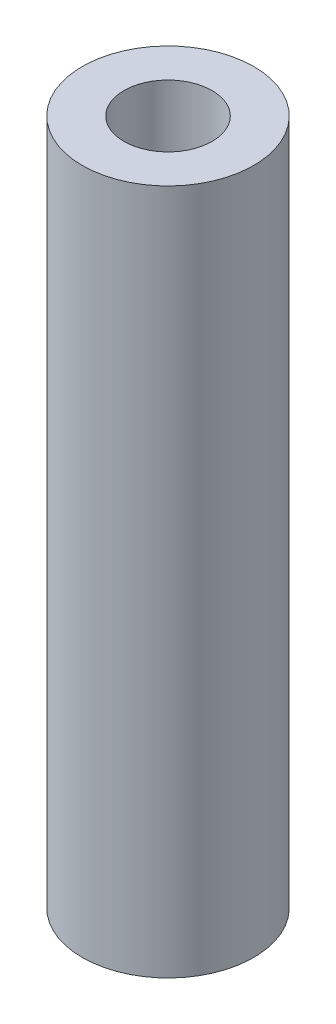
from build123d import *

# Parameters (mm, degrees)
SKETCH1_R           = 3.175
BOSS_EXTRUDE1_DEPTH = 25.4
SKETCH2_R           = 1.63195
CUT_EXTRUDE1_DEPTH  = 26.793821935


with BuildPart() as part:
    # Sketch1 → Boss-Extrude1 (new body)
    with BuildSketch(Plane(origin=(0, 0, 0), x_dir=(1, 0, 0), z_dir=(0, 1, 0))):
        with Locations(Location((0, 0, 0), (0, 0, 270))):
            Circle(SKETCH1_R)
    extrude(amount=BOSS_EXTRUDE1_DEPTH)

    # Sketch2 → Cut-Extrude1 (cut, through all)
    with BuildSketch(Plane(origin=(0, 25.4, 0), x_dir=(1, 0, 0), z_dir=(0, 1, 0))):
        with Locations(Location((0, 0, 0), (0, 0, 270))):
            Circle(SKETCH2_R)
    extrude(amount=-CUT_EXTRUDE1_DEPTH, mode=Mode.SUBTRACT)


solid = part.part
